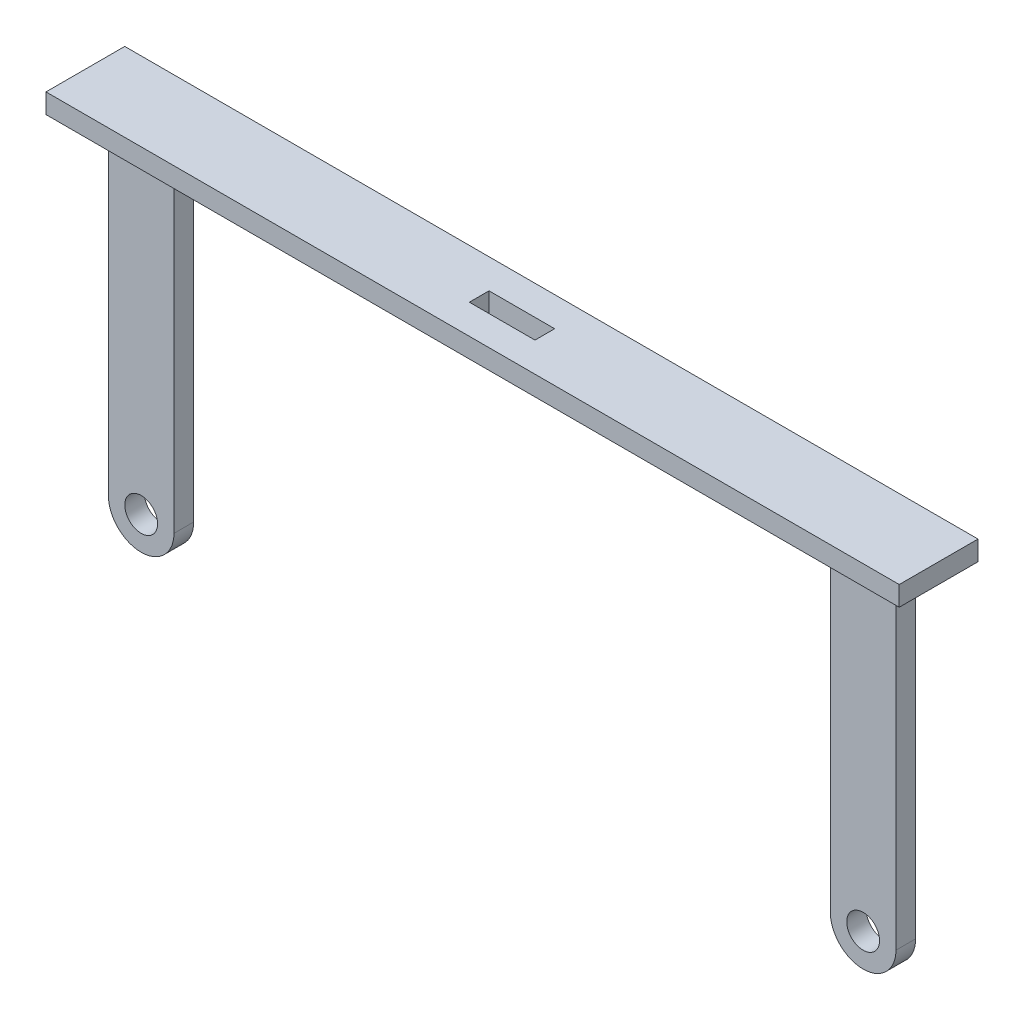
from build123d import *

# Parameters (mm, degrees)
SKETCH1_R           = 2.5
BOSS_EXTRUDE1_DEPTH = 3
SKETCH2_W           = 130
SKETCH2_H           = 12
BOSS_EXTRUDE2_DEPTH = 3
SKETCH3_W           = 10
SKETCH3_H           = 3
CUT_EXTRUDE1_DEPTH  = 3


with BuildPart() as part:
    # Sketch1 → Boss-Extrude1 (new body)
    with BuildSketch(Plane.XY):
        with BuildLine():
            Line((-50, -51.5), (-50, -1.5))
            Line((-50, -1.5), (50, -1.5))
            Line((50, -1.5), (50, -51.5))
            ThreePointArc((50, -51.5), (55, -56.5), (60, -51.5))
            Line((60, -51.5), (60, -1.5))
            Line((60, -1.5), (65, -1.5))
            Line((65, -1.5), (65, 1.5))
            Line((65, 1.5), (-65, 1.5))
            Line((-65, 1.5), (-65, -1.5))
            Line((-65, -1.5), (-60, -1.5))
            Line((-60, -1.5), (-60, -51.5))
            ThreePointArc((-60, -51.5), (-55, -56.5), (-50, -51.5))
        make_face()
        with Locations((-55, -51.5)):
            Circle(SKETCH1_R, mode=Mode.SUBTRACT)
        with Locations((55, -51.5)):
            Circle(SKETCH1_R, mode=Mode.SUBTRACT)
    extrude(amount=BOSS_EXTRUDE1_DEPTH)

    # Sketch2 → Boss-Extrude2 (add)
    with BuildSketch(Plane(origin=(0, 1.5, 0), x_dir=(1, 0, 0), z_dir=(0, 1, 0))):
        with Locations((0, -1.5)):
            Rectangle(SKETCH2_W, SKETCH2_H)
    extrude(amount=-BOSS_EXTRUDE2_DEPTH)

    # Sketch3 → Cut-Extrude1 (cut)
    with BuildSketch(Plane(origin=(0, 1.5, 0), x_dir=(1, 0, 0), z_dir=(0, 1, 0))):
        with Locations((0, -1.5)):
            Rectangle(SKETCH3_W, SKETCH3_H)
    extrude(amount=-CUT_EXTRUDE1_DEPTH, mode=Mode.SUBTRACT)


solid = part.part
